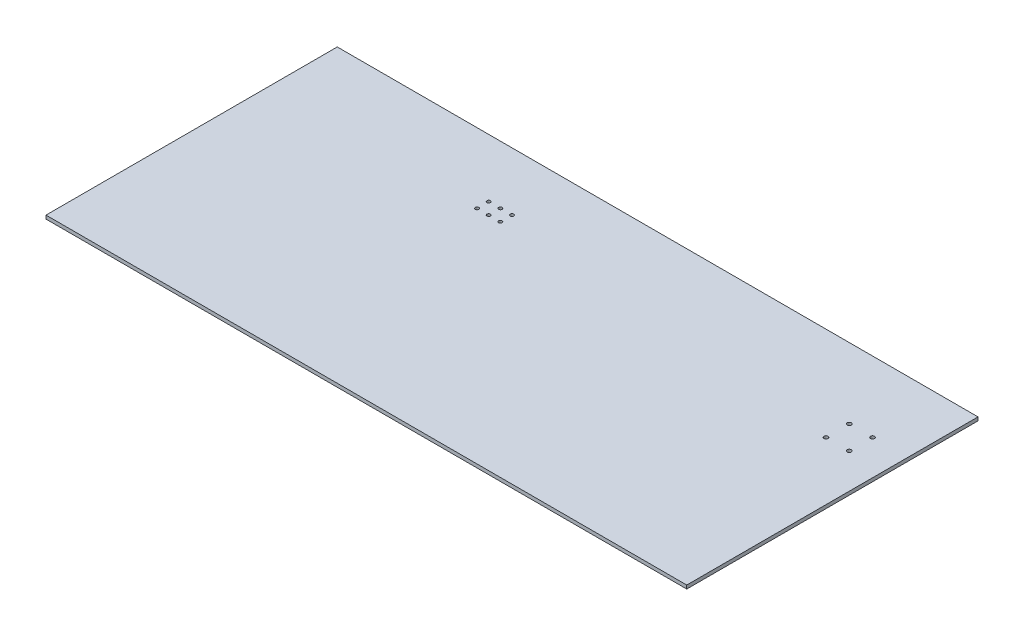
from build123d import *

# Parameters (mm, degrees)
SKETCH1_W           = 550
SKETCH1_H           = 250
BOSS_EXTRUDE1_DEPTH = 3
SKETCH2_R           = 1.75
CUT_EXTRUDE1_DEPTH  = 10
SKETCH4_R           = 1.5
CUT_EXTRUDE3_DEPTH  = 20


with BuildPart() as part:
    # Sketch1 → Boss-Extrude1 (new body)
    with BuildSketch(Plane(origin=(0, 0, 0), x_dir=(1, 0, 0), z_dir=(0, 1, 0))):
        Rectangle(SKETCH1_W, SKETCH1_H)
    extrude(amount=BOSS_EXTRUDE1_DEPTH)

    # Sketch2 → Cut-Extrude1 (cut)
    with BuildSketch(Plane(origin=(0, 3, 0), x_dir=(1, 0, 0), z_dir=(0, 1, 0))):
        with Locations((225, 64.5)):
            Circle(SKETCH2_R)
        with Locations((245, 64.5)):
            Circle(SKETCH2_R)
        with Locations((225, 44.5)):
            Circle(SKETCH2_R)
        with Locations((245, 44.5)):
            Circle(SKETCH2_R)
    extrude(amount=-CUT_EXTRUDE1_DEPTH, mode=Mode.SUBTRACT)

    # Sketch4 → Cut-Extrude3 (cut)
    with BuildSketch(Plane(origin=(0, 3, 0), x_dir=(1, 0, 0), z_dir=(0, 1, 0))):
        with Locations((-95, 65)):
            Circle(SKETCH4_R)
        with Locations((-85, 65)):
            Circle(SKETCH4_R)
        with Locations((-75, 65)):
            Circle(SKETCH4_R)
        with Locations((-85, 75)):
            Circle(SKETCH4_R)
        with Locations((-75, 75)):
            Circle(SKETCH4_R)
        with Locations((-95, 75)):
            Circle(SKETCH4_R)
    extrude(amount=-CUT_EXTRUDE3_DEPTH, mode=Mode.SUBTRACT)


solid = part.part
